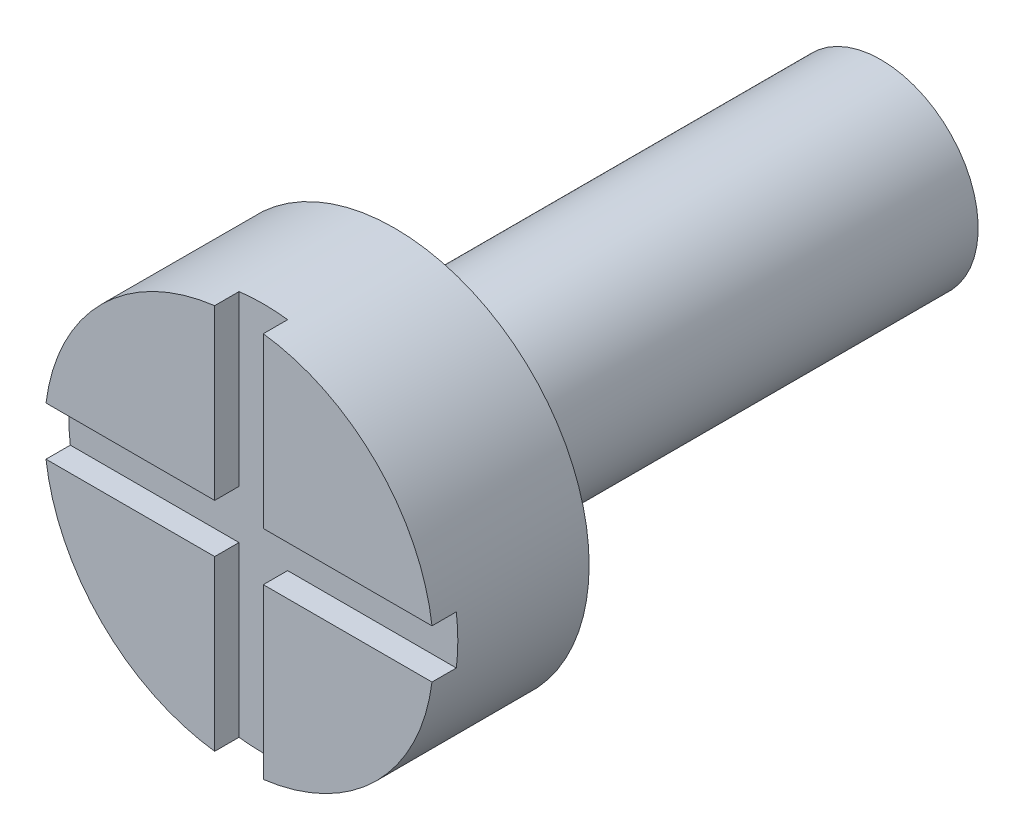
from build123d import *

# Parameters (mm, degrees)
CUT_EXTRUDE1_DEPTH = 0.25


with BuildPart() as part:
    # Sketch1 → Revolve1 (revolve)
    with BuildSketch(Plane(origin=(0, 0, 0), x_dir=(0, 0, -1), z_dir=(1, 0, 0))):
        Polygon((0, 1), (0, 2), (-1.6, 2), (-1.6, 0), (5, 0), (5, 1), align=None)
    revolve(axis=Axis((0, 0, -5), (0, 0, 1)))

    # Sketch2 → Cut-Extrude1 (cut)
    with BuildSketch(Plane.XY.offset(1.6)):
        Polygon((-2, -0.25), (-0.25, -0.25), (-0.25, -2), (0, -2.25), (0.25, -2), (0.25, -0.25), (2, -0.25), (2.364373172, -0.114373172), (2, 0.25), (0.25, 0.25), (0.25, 2), (0, 2.480239465), (-0.25, 2), (-0.25, 0.25), (-2, 0.25), (-2.25, 0), align=None)
    extrude(amount=-CUT_EXTRUDE1_DEPTH, mode=Mode.SUBTRACT)


solid = part.part
